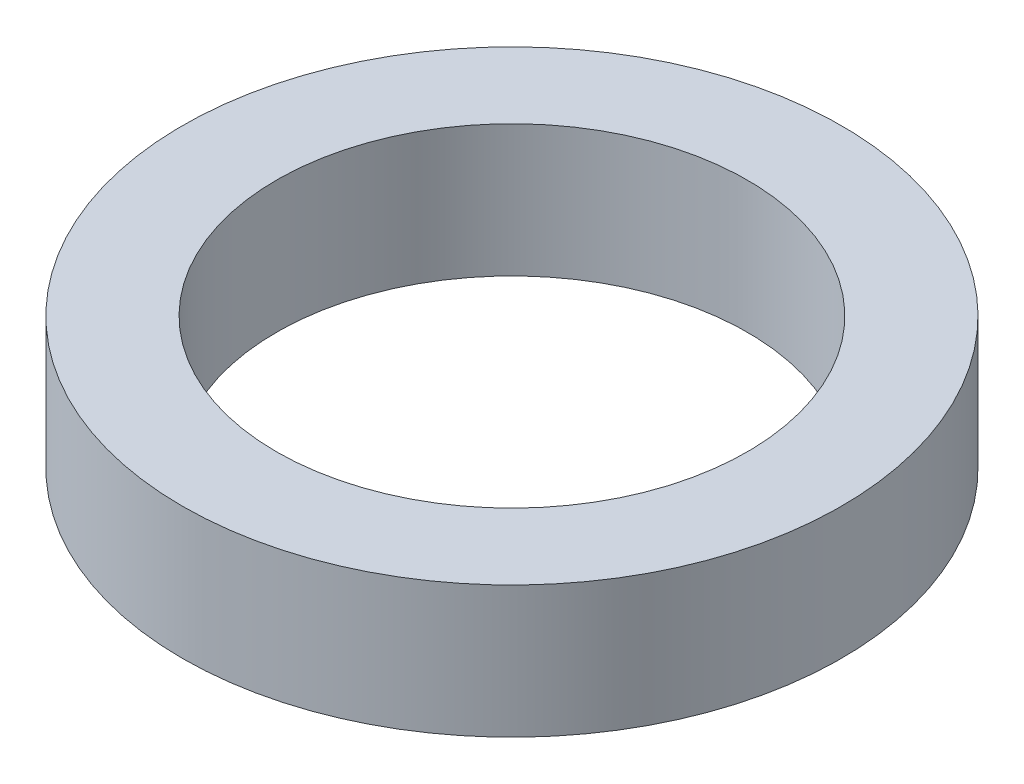
from build123d import *

# Parameters (mm, degrees)
SKETCH1_R           = 35
SKETCH1_R_2         = 25
BOSS_EXTRUDE1_DEPTH = 14


with BuildPart() as part:
    # Sketch1 → Boss-Extrude1 (new body)
    with BuildSketch(Plane(origin=(0, 0, 0), x_dir=(1, 0, 0), z_dir=(0, 1, 0))):
        with Locations(Location((0, 0, 0), (0, 0, 270))):
            Circle(SKETCH1_R)
        with Locations(Location((0, 0, 0), (0, 0, 270))):
            Circle(SKETCH1_R_2, mode=Mode.SUBTRACT)
    extrude(amount=BOSS_EXTRUDE1_DEPTH)


solid = part.part
